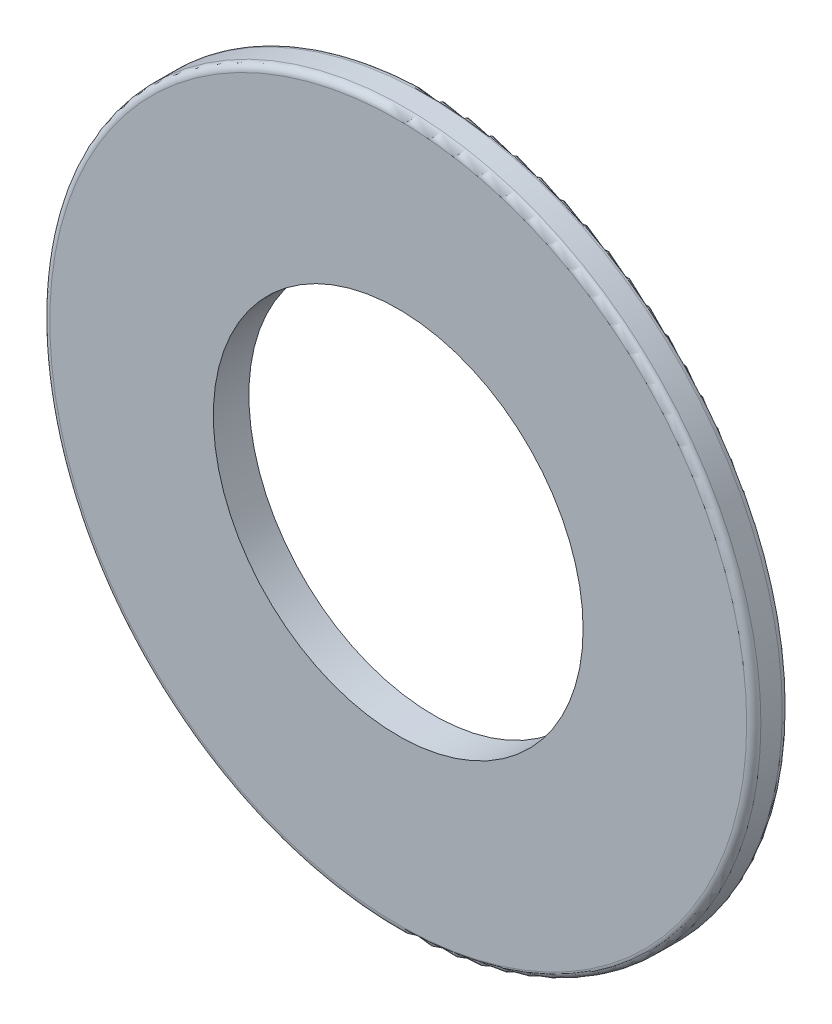
from build123d import *

# Parameters (mm, degrees)
SKETCH_1_R      = 5
SKETCH_1_R_2    = 2.6
EXTRUDE_1_DEPTH = 0.5
FILLET_1_R      = 0.1


with BuildPart() as part:
    # 草图1 → 凸台-拉伸1 (new body)
    with BuildSketch(Plane.XY):
        Circle(SKETCH_1_R)
        Circle(SKETCH_1_R_2, mode=Mode.SUBTRACT)
    extrude(amount=EXTRUDE_1_DEPTH)

    # 圆角1
    fillet_1_edges = [part.edges().sort_by_distance(p)[0] for p in [
        (-5, 0, 0),
        (-5, 0, 0.5),
    ]]
    fillet(fillet_1_edges, radius=FILLET_1_R)


solid = part.part
